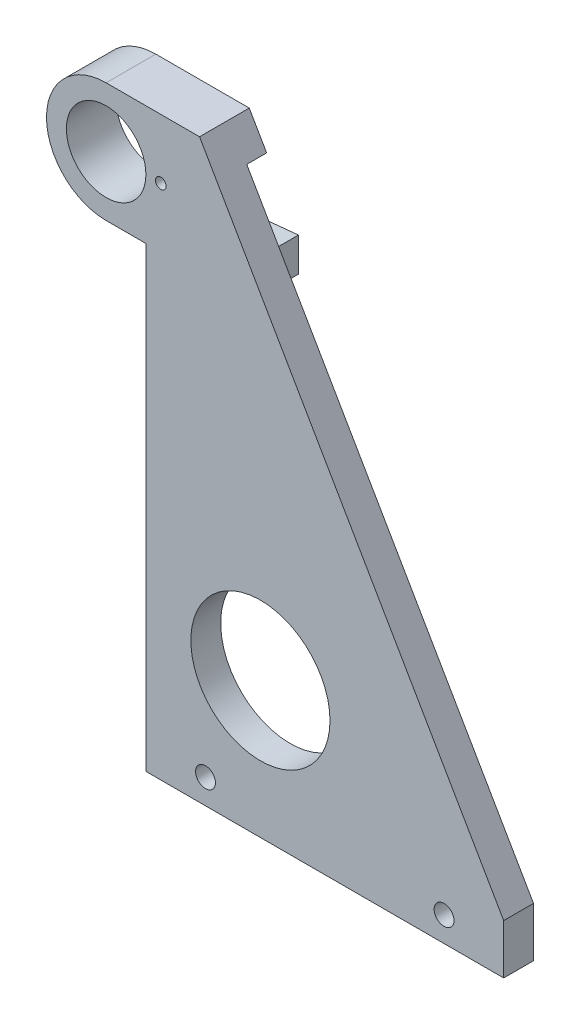
from build123d import *

# Parameters (mm, degrees)
EXTRUDE_1_DEPTH     = 3
SKETCH_3_R          = 7
CUT_EXTRUDE_1_DEPTH = 65.474801279
SKETCH_4_R          = 1
CUT_EXTRUDE_2_DEPTH = 65.474801279
FILLET_1_RADIUS     = 6
FILLET_1_LENGTH     = 3
EXTRUDE_2_DEPTH     = 2
SKETCH_7_R          = 4
CUT_EXTRUDE_3_DEPTH = 65.598761598
CUT_EXTRUDE_4_DEPTH = 2
SKETCH_9_R          = 0.537141257
CUT_EXTRUDE_5_DEPTH = 65.474801279
SKETCH_10_R         = 1.85
CUT_EXTRUDE_6_DEPTH = 1.5


with BuildPart() as part:
    # 草图1 → 凸台-拉伸1 (new body)
    with BuildSketch(Plane.XY):
        Polygon((-18, 0), (18, 0), (18, 5), (-12.599564267, 58), (-28, 58), (-28, 46), (-18, 46), align=None)
    extrude(amount=EXTRUDE_1_DEPTH)

    # 草图3 → 切除-拉伸1 (cut, through all)
    with BuildSketch(Plane.XY.offset(3)):
        with Locations((-6.476357534, 13.687539211)):
            Circle(SKETCH_3_R)
    extrude(amount=-CUT_EXTRUDE_1_DEPTH, mode=Mode.SUBTRACT)

    # 草图4 → 切除-拉伸2 (cut, through all)
    with BuildSketch(Plane.XY.offset(3)):
        with Locations((12, 2.5)):
            Circle(SKETCH_4_R)
        with Locations(Location((-12, 2.5, 0), (0, 0, 180))):
            Circle(SKETCH_4_R)
    extrude(amount=-CUT_EXTRUDE_2_DEPTH, mode=Mode.SUBTRACT)

    # 圆角1: full round fillet: the end face becomes a half cylinder, R = half its width
    fillet_1_face = Plane((-28, 52, 1.5), x_dir=(0, 0, 1), z_dir=(-1, 0, 0))  # on the end face: x along it, z out of the body
    fillet_1_slab = fillet_1_face.offset(-FILLET_1_RADIUS / 2) * Box(FILLET_1_LENGTH, 2 * FILLET_1_RADIUS, FILLET_1_RADIUS, mode=Mode.PRIVATE)  # the body's end, R deep
    fillet_1_round = Plane((-22, 52, 1.5), x_dir=(-1, 0, 0), z_dir=(0, 0, 1)) * Cylinder(FILLET_1_RADIUS, FILLET_1_LENGTH, mode=Mode.PRIVATE)  # its axis R under the face
    add(fillet_1_slab - fillet_1_round, mode=Mode.SUBTRACT)

    # 草图6 → 凸台-拉伸2 (add)
    with BuildSketch(Plane(origin=(0, 0, 0), x_dir=(-1, 0, 0), z_dir=(0, 0, -1))):
        with BuildLine():
            Line((22, 58), (12.599564267, 58))
            Line((12.599564267, 58), (7.650807626, 49.428502063))
            Line((7.650807626, 49.428502063), (7.650807626, 46))
            Line((7.650807626, 46), (22, 46))
            ThreePointArc((22, 46), (28, 52), (22, 58))
        make_face()
    extrude(amount=EXTRUDE_2_DEPTH)

    # 草图7 → 切除-拉伸3 (cut, through all)
    with BuildSketch(Plane.XY.offset(3)):
        with Locations((-22, 52)):
            Circle(SKETCH_7_R)
    extrude(amount=-CUT_EXTRUDE_3_DEPTH, mode=Mode.SUBTRACT)

    # 草图8 → 切除-拉伸4 (cut)
    with BuildSketch(Plane(origin=(0, 0, -2), x_dir=(-1, 0, 0), z_dir=(0, 0, -1))):
        Polygon((21.170465578, 55.913038799), (21.170465578, 48.086961201), (7.021339854, 49.472936706), (7.021339854, 54.618719507), align=None)
    extrude(amount=-CUT_EXTRUDE_4_DEPTH, mode=Mode.SUBTRACT)

    # 草图9 → 切除-拉伸5 (cut, through all)
    with BuildSketch(Plane(origin=(0, 0, 0), x_dir=(-1, 0, 0), z_dir=(0, 0, -1))):
        with Locations((16.5, 52)):
            Circle(SKETCH_9_R)
    extrude(amount=-CUT_EXTRUDE_5_DEPTH, mode=Mode.SUBTRACT)

    # 草图10 → 切除-拉伸6 (cut)
    with BuildSketch(Plane(origin=(0, 0, 0), x_dir=(-1, 0, 0), z_dir=(0, 0, -1))):
        with Locations((12, 2.5)):
            Circle(SKETCH_10_R)
        with Locations((-12, 2.5)):
            Circle(SKETCH_10_R)
    extrude(amount=-CUT_EXTRUDE_6_DEPTH, mode=Mode.SUBTRACT)


solid = part.part
